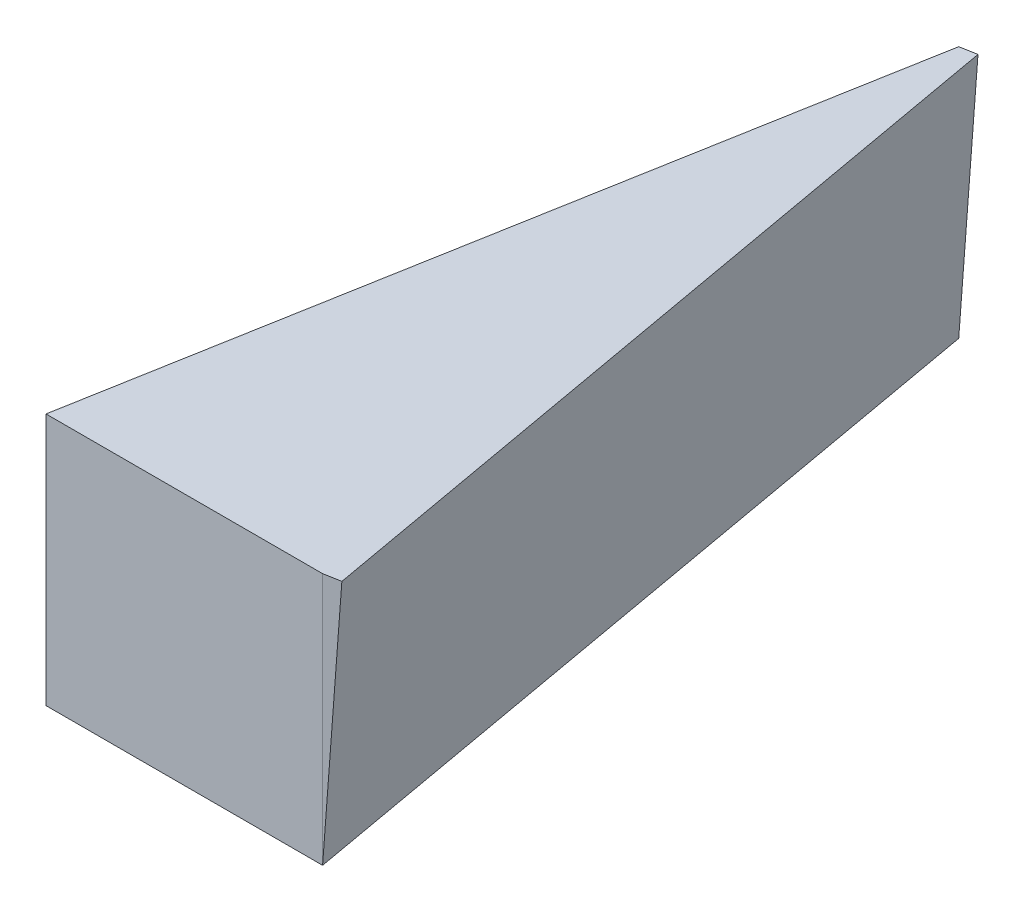
from build123d import *

# Parameters (mm, degrees)
MAIN_BLOCK_EXTRUDE_DEPTH = 65.09
SHELL1_T                 = -5
SLANT_DEPTH              = 405.38


with BuildPart() as part:
    # Sketch1 → Main block extrude (new, symmetric)
    with BuildSketch(Plane(origin=(0, 0, 0), x_dir=(1, 0, 0), z_dir=(0, 1, 0))):
        Polygon((0, 0), (-71.265, -399.066716446), (71.265, -399.066716446), align=None)
    extrude(amount=MAIN_BLOCK_EXTRUDE_DEPTH, both=True)

    # Shell1
    shell1_openings = [part.faces().sort_by_distance(p)[0] for p in [
        (0, -65.09, 266.044477631),
    ]]
    offset(amount=SHELL1_T, openings=shell1_openings, kind=Kind.INTERSECTION)

    # Sketch2 → Slant (add)
    with BuildSketch(Plane(origin=(71.265, 0, 399.066716446), x_dir=(0, -1, 0), z_dir=(0.17579801667571168, 0, 0.9844262579456555))):
        Polygon((-65.09, 0), (65.09, 0), (-65.09, 8.560443406), align=None)
    extrude(amount=-SLANT_DEPTH)


solid = part.part
